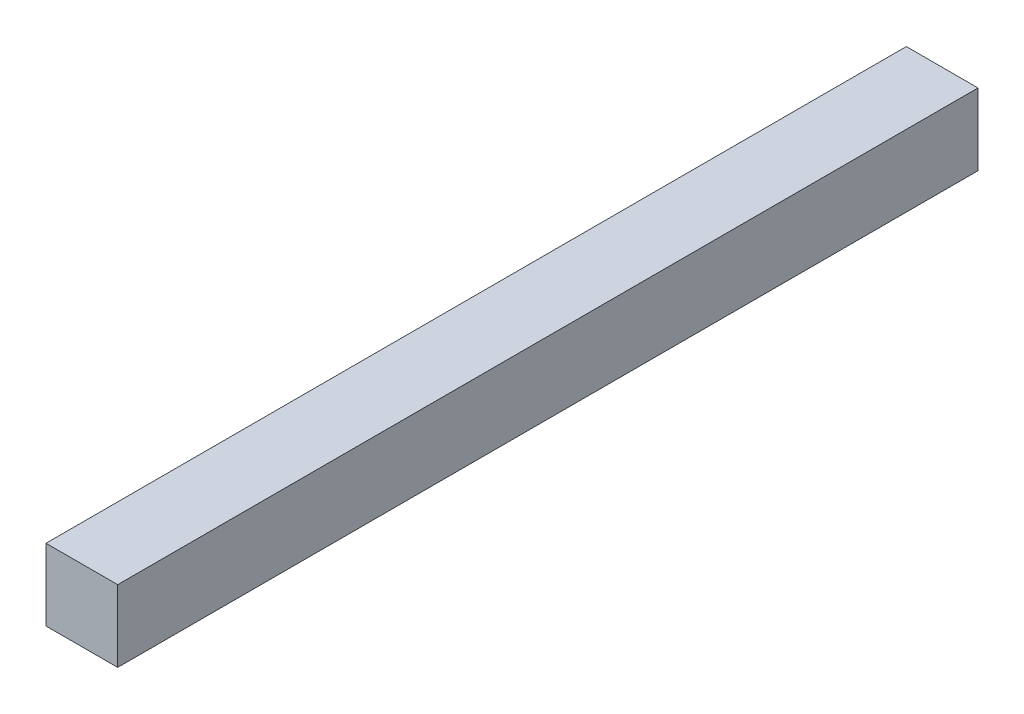
from build123d import *

# Parameters (mm, degrees)
SKETCH1_W           = 3.175
SKETCH1_H           = 3.175
BOSS_EXTRUDE1_DEPTH = 38.1


with BuildPart() as part:
    # Sketch1 → Boss-Extrude1 (new body)
    with BuildSketch(Plane.XY):
        with Locations((-1.5875, 1.5875)):
            Rectangle(SKETCH1_W, SKETCH1_H)
    extrude(amount=BOSS_EXTRUDE1_DEPTH)


solid = part.part
